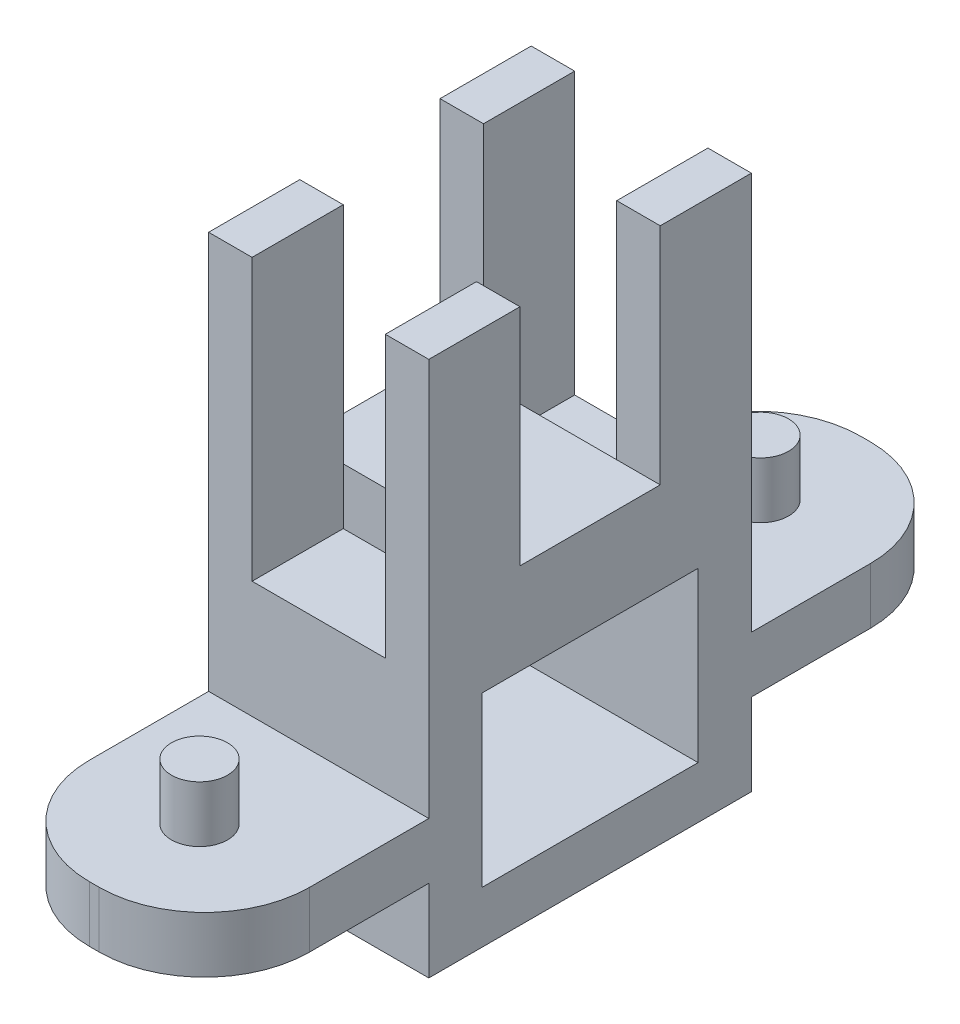
from build123d import *

# Parameters (mm, degrees)
SKETCH4_W               = 31.4
SKETCH4_H               = 31.4
SKETCH4_W_2             = 25.4
SKETCH4_H_2             = 25.4
BOSS_EXTRUDE3_DEPTH     = 30
SKETCH5_W               = 31.4
SKETCH5_H               = 31.4
BOSS_EXTRUDE4_DEPTH     = 5
SKETCH6_W               = 31.4
SKETCH6_H               = 8
BOSS_EXTRUDE5_DEPTH     = 5
BOSS_EXTRUDE6_DEPTH     = 8
SKETCH8_R               = 4
BOSS_EXTRUDE7_DEPTH     = 8
SKETCH9_W               = 31.4
SKETCH9_H               = 10
BOSS_EXTRUDE8_DEPTH     = 5
SKETCH10_W              = 31.4
SKETCH10_H              = 10
BOSS_EXTRUDE9_DEPTH     = 13
SKETCH11_W              = 6.2
SKETCH11_H              = 10
BOSS_EXTRUDE10_DEPTH    = 40
BOSS_EXTRUDE11_DEPTH    = 3
SKETCH13_W              = 31.4
SKETCH13_H              = 31.4
CUT_EXTRUDE1_DEPTH      = 31.4
SKETCH14_W              = 31.4
SKETCH14_H              = 31.4
BOSS_EXTRUDE12_DEPTH    = 4
SKETCH16_W              = 31.4
SKETCH16_H              = 8
BOSS_EXTRUDE13_DEPTH    = 15.4
MIRROR2_COPY_1_SKETCH_R = 4
MIRROR2_COPY_1_DEPTH    = 8
SKETCH17_W              = 30.8
SKETCH17_H              = 24
CUT_EXTRUDE2_DEPTH      = 31.4


with BuildPart() as part:
    # Sketch4 → Boss-Extrude3 (new body)
    with BuildSketch(Plane.XY):
        Rectangle(SKETCH4_W, SKETCH4_H)
        Rectangle(SKETCH4_W_2, SKETCH4_H_2, mode=Mode.SUBTRACT)
    boss_extrude3 = extrude(amount=BOSS_EXTRUDE3_DEPTH)

    # Sketch5 → Boss-Extrude4 (add)
    with BuildSketch(Plane.XY.offset(30)):
        Rectangle(SKETCH5_W, SKETCH5_H)
    boss_extrude4 = extrude(amount=BOSS_EXTRUDE4_DEPTH)

    # Sketch6 → Boss-Extrude5 (add)
    with BuildSketch(Plane.XY.offset(35)):
        Rectangle(SKETCH6_W, SKETCH6_H)
    boss_extrude5 = extrude(amount=BOSS_EXTRUDE5_DEPTH)

    # Sketch7 → Boss-Extrude6 (add)
    with BuildSketch(Plane.XZ.offset(4)):
        with BuildLine():
            Line((-15.7, 40), (-15.7, 52))
            ThreePointArc((-15.7, 52), (-11.306601718, 62.606601718), (-0.7, 67))
            Line((-0.7, 67), (0.7, 67))
            ThreePointArc((0.7, 67), (11.306601718, 62.606601718), (15.7, 52))
            Line((15.7, 52), (15.7, 40))
            Line((15.7, 40), (-15.7, 40))
        make_face()
    boss_extrude6 = extrude(amount=-BOSS_EXTRUDE6_DEPTH)

    # Sketch8 → Boss-Extrude7 (add)
    with BuildSketch(Plane.XZ.offset(4)):
        with Locations(Location((0, 52, 0), (0, 0, 180))):
            Circle(SKETCH8_R)
    boss_extrude7 = extrude(amount=BOSS_EXTRUDE7_DEPTH)

    # Mirror1: Boss-Extrude7 across plane
    add(boss_extrude7.mirror(Plane.ZX))

    # Sketch9 → Boss-Extrude8 (add)
    with BuildSketch(Plane(origin=(0, 15.7, 0), x_dir=(1, 0, 0), z_dir=(0, 1, 0))):
        with Locations((0, -27)):
            Rectangle(SKETCH9_W, SKETCH9_H)
    boss_extrude8 = extrude(amount=BOSS_EXTRUDE8_DEPTH)

    # Sketch10 → Boss-Extrude9 (add)
    with BuildSketch(Plane(origin=(0, 15.7, 0), x_dir=(1, 0, 0), z_dir=(0, 1, 0))):
        with Locations((0, -17)):
            Rectangle(SKETCH10_W, SKETCH10_H)
    boss_extrude9 = extrude(amount=BOSS_EXTRUDE9_DEPTH)

    # Sketch11 → Boss-Extrude10 (add)
    with BuildSketch(Plane(origin=(0, 20.7, 0), x_dir=(1, 0, 0), z_dir=(0, 1, 0))):
        with Locations((-12.6, -27)):
            Rectangle(SKETCH11_W, SKETCH11_H)
        with Locations((12.6, -27)):
            Rectangle(SKETCH11_W, SKETCH11_H)
    boss_extrude10 = extrude(amount=BOSS_EXTRUDE10_DEPTH)

    # Sketch12 → Boss-Extrude11 (add)
    with BuildSketch(Plane.XY.offset(32)):
        Polygon((-15.7, 60.7), (-9.5, 60.7), (-9.5, 20.7), (9.5, 20.7), (9.5, 60.7), (15.7, 60.7), (15.7, 15.7), (-15.7, 15.7), align=None)
    boss_extrude11 = extrude(amount=BOSS_EXTRUDE11_DEPTH)

    # Sketch13 → Cut-Extrude1 (cut)
    with BuildSketch(Plane.ZY.offset(15.7)):
        with Locations((15.7, 0)):
            Rectangle(SKETCH13_W, SKETCH13_H)
    extrude(amount=-CUT_EXTRUDE1_DEPTH, mode=Mode.SUBTRACT)

    # Sketch14 → Boss-Extrude12 (add)
    with BuildSketch(Plane(origin=(0, 0, 31.4), x_dir=(-1, 0, 0), z_dir=(0, 0, -1))):
        Rectangle(SKETCH14_W, SKETCH14_H)
    boss_extrude12 = extrude(amount=BOSS_EXTRUDE12_DEPTH)

    # Sketch16 → Boss-Extrude13 (add)
    with BuildSketch(Plane(origin=(0, 0, 27.4), x_dir=(-1, 0, 0), z_dir=(0, 0, -1))):
        with Locations((0, -11.7)):
            Rectangle(SKETCH16_W, SKETCH16_H)
    boss_extrude13 = extrude(amount=BOSS_EXTRUDE13_DEPTH)

    # Mirror2: Boss-Extrude3, Boss-Extrude4, Boss-Extrude5, Boss-Extrude6, Boss-Extrude7, Boss-Extrude8, Boss-Extrude9, Boss-Extrude10, Boss-Extrude11, Boss-Extrude12, Boss-Extrude13 across plane
    add(boss_extrude3.mirror(Plane(origin=(-15.7, 28.7, 12), x_dir=(1, 0, 0), z_dir=(0, 0, 1))))
    add(boss_extrude4.mirror(Plane(origin=(-15.7, 28.7, 12), x_dir=(1, 0, 0), z_dir=(0, 0, 1))))
    add(boss_extrude5.mirror(Plane(origin=(-15.7, 28.7, 12), x_dir=(1, 0, 0), z_dir=(0, 0, 1))))
    add(boss_extrude6.mirror(Plane(origin=(-15.7, 28.7, 12), x_dir=(1, 0, 0), z_dir=(0, 0, 1))))
    add(boss_extrude7.mirror(Plane(origin=(-15.7, 28.7, 12), x_dir=(1, 0, 0), z_dir=(0, 0, 1))))
    add(boss_extrude8.mirror(Plane(origin=(-15.7, 28.7, 12), x_dir=(1, 0, 0), z_dir=(0, 0, 1))))
    add(boss_extrude9.mirror(Plane(origin=(-15.7, 28.7, 12), x_dir=(1, 0, 0), z_dir=(0, 0, 1))))
    add(boss_extrude10.mirror(Plane(origin=(-15.7, 28.7, 12), x_dir=(1, 0, 0), z_dir=(0, 0, 1))))
    add(boss_extrude11.mirror(Plane(origin=(-15.7, 28.7, 12), x_dir=(1, 0, 0), z_dir=(0, 0, 1))))
    add(boss_extrude12.mirror(Plane(origin=(-15.7, 28.7, 12), x_dir=(1, 0, 0), z_dir=(0, 0, 1))))
    add(boss_extrude13.mirror(Plane(origin=(-15.7, 28.7, 12), x_dir=(1, 0, 0), z_dir=(0, 0, 1))))

    # Mirror2 copy 1 sketch → Mirror2 copy 1 (add)
    with BuildSketch(Plane(origin=(0, 4, 24), x_dir=(1, 0, 0), z_dir=(0, 1, 0))):
        with Locations(Location((0, 52, 0), (0, 0, 180))):
            Circle(MIRROR2_COPY_1_SKETCH_R)
    extrude(amount=MIRROR2_COPY_1_DEPTH)

    # Sketch17 → Cut-Extrude2 (cut)
    with BuildSketch(Plane.ZY.offset(15.7)):
        with Locations((12, 3.7)):
            Rectangle(SKETCH17_W, SKETCH17_H)
    extrude(amount=-CUT_EXTRUDE2_DEPTH, mode=Mode.SUBTRACT)


solid = part.part
